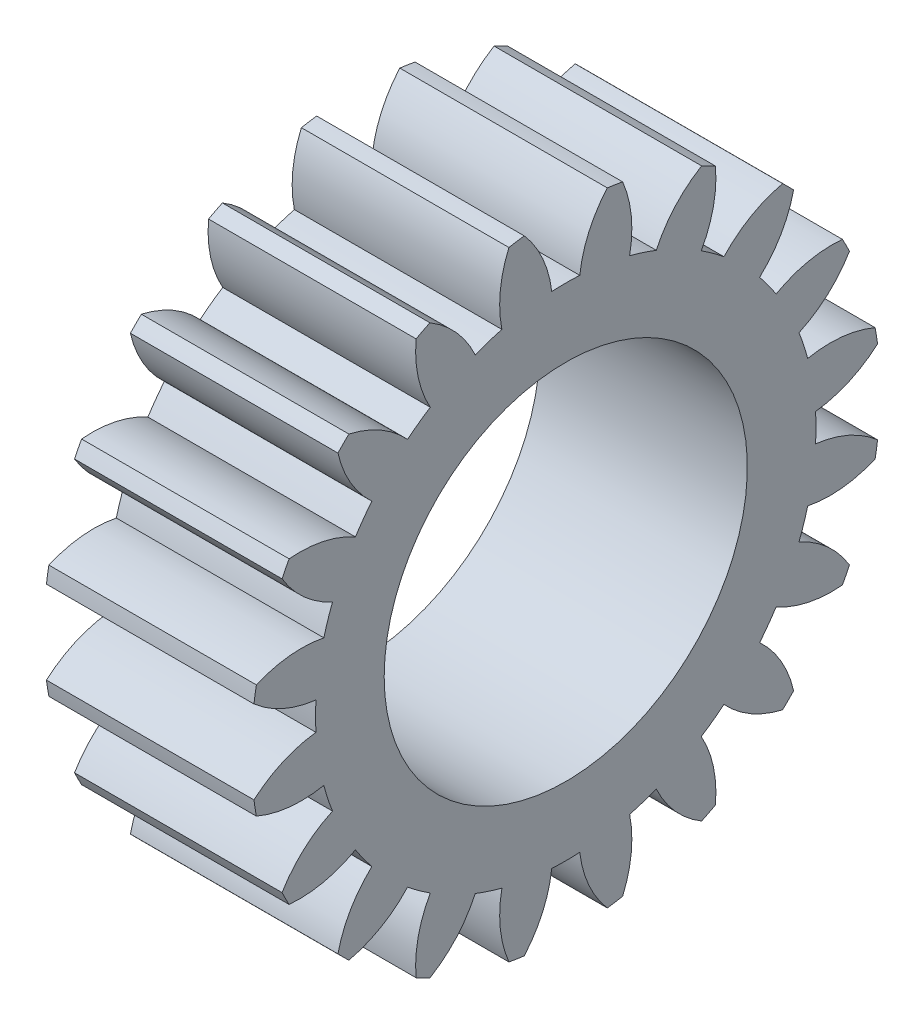
from build123d import *

# Parameters (mm, degrees)
BASPROSKE_W        = 508
BASPROSKE_H        = 770
TOOTHCUT_DEPTH     = 1202.608921405
TEETHCUTS_COUNT    = 20
TEETHCUTS_ANGLE    = 342
BORSKE_R           = 250
BORE_DEPTH         = 508.0000508
SKETCH1_R          = 444.5
CUT_EXTRUDE1_DEPTH = 508


with BuildPart() as part:
    # BasProSke → Base-Revolve (revolve)
    with BuildSketch(Plane(origin=(0, 0, 0), x_dir=(1, 0, 0), z_dir=(0, 1, 0)), mode=Mode.PRIVATE) as base_revolve_sk:
        with Locations((254, 385)):
            Rectangle(BASPROSKE_W, BASPROSKE_H)
    revolve(base_revolve_sk.sketch.rotate(Axis((-10, 0, 0), (1, 0, 0)), 180), axis=Axis((-10, 0, 0), (1, 0, 0)))

    # TooCutSke → ToothCut (cut, through all)
    with BuildSketch(Plane(origin=(0, 0, 0), x_dir=(0, 0, -1), z_dir=(1, 0, 0))):
        with BuildLine():
            ThreePointArc((34.297719874, 611.537972175), (0, 612.499), (-34.297719874, 611.537972175))
            ThreePointArc((-34.297719874, 611.537972175), (-56.486068903, 692.519757006), (-101.687045314, 763.281639672))
            ThreePointArc((-101.687045314, 763.281639672), (0, 770.0254), (101.687045314, 763.281639672))
            ThreePointArc((101.687045314, 763.281639672), (56.486068903, 692.519757006), (34.297719874, 611.537972175))
        make_face()
    toothcut = extrude(amount=TOOTHCUT_DEPTH, mode=Mode.SUBTRACT)

    # TeethCuts: ToothCut ×20 about axis
    teethcuts_axis = Axis((-10, 0, 0), (1, 0, 0))
    for i in range(1, TEETHCUTS_COUNT):
        add(toothcut.rotate(teethcuts_axis, i * TEETHCUTS_ANGLE / (TEETHCUTS_COUNT - 1)), mode=Mode.SUBTRACT)

    # BorSke → Bore (cut, symmetric)
    with BuildSketch(Plane(origin=(0, 0, 0), x_dir=(0, 0, -1), z_dir=(1, 0, 0))):
        with Locations(Location((0, 0, 0), (0, 0, 180))):
            Circle(BORSKE_R)
    extrude(amount=BORE_DEPTH, both=True, mode=Mode.SUBTRACT)

    # Sketch1 → Cut-Extrude1 (cut)
    with BuildSketch(Plane.ZY):
        Circle(SKETCH1_R)
    extrude(amount=-CUT_EXTRUDE1_DEPTH, mode=Mode.SUBTRACT)


solid = part.part
